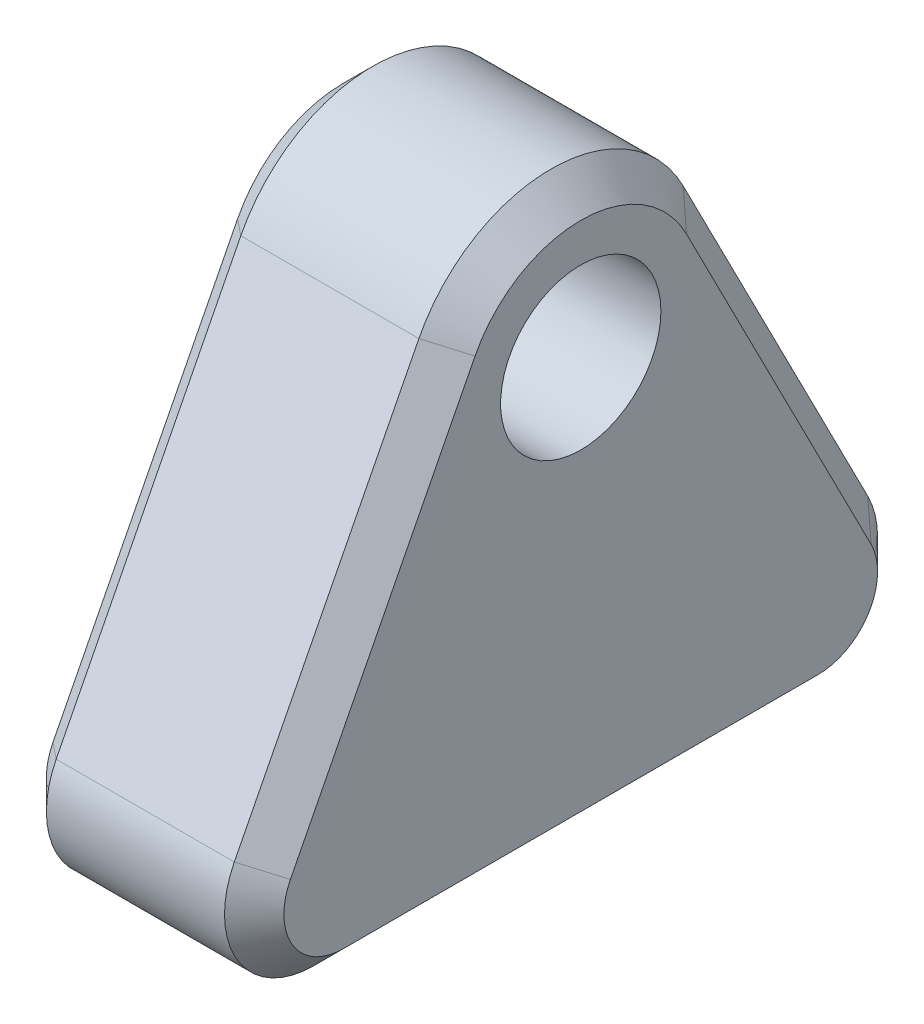
from build123d import *

# Parameters (mm, degrees)
SKETCH1_R           = 2.7
BOSS_EXTRUDE1_DEPTH = 4
CHAMFER1_SIZE       = 1
SKETCH3_R           = 2.4
CUT_EXTRUDE1_DEPTH  = 7
CHAMFER2_SIZE       = 0.5


with BuildPart() as part:
    # Sketch1 → Boss-Extrude1 (new, symmetric)
    with BuildSketch(Plane(origin=(0, 0, 0), x_dir=(0, 0, -1), z_dir=(1, 0, 0))):
        with BuildLine():
            Line((-4.451593815, 2.276688935), (-10.670956289, -9.883986639))
            ThreePointArc((-10.670956289, -9.883986639), (-10.559105321, -12.815560589), (-8, -14.25))
            Line((-8, -14.25), (8, -14.25))
            ThreePointArc((8, -14.25), (10.559105321, -12.815560589), (10.670956289, -9.883986639))
            Line((10.670956289, -9.883986639), (4.451593815, 2.276688935))
            ThreePointArc((4.451593815, 2.276688935), (0, 5), (-4.451593815, 2.276688935))
        make_face()
        Circle(SKETCH1_R, mode=Mode.SUBTRACT)
    extrude(amount=BOSS_EXTRUDE1_DEPTH, both=True)

    # Chamfer1
    chamfer1_edges = [part.edges().sort_by_distance(p)[0] for p in [
        (4, -12.815560589, 10.559105321),
        (4, -14.25, 0),
        (4, -12.815560589, -10.559105321),
        (4, -3.803648852, -7.561275052),
        (4, 5, 0),
        (-4, -3.803648852, -7.561275052),
        (-4, -12.815560589, -10.559105321),
        (-4, -14.25, 0),
        (-4, -12.815560589, 10.559105321),
        (-4, -3.803648852, 7.561275052),
        (-4, 5, 0),
        (4, -3.803648852, 7.561275052),
    ]]
    chamfer(chamfer1_edges, length=CHAMFER1_SIZE)

    # Sketch3 → Cut-Extrude1 (cut)
    with BuildSketch(Plane.XZ.offset(14.25)):
        with Locations(Location((0, 5, 0), (0, 0, 270))):
            Circle(SKETCH3_R)
        with Locations(Location((0, -5, 0), (0, 0, 270))):
            Circle(SKETCH3_R)
    extrude(amount=-CUT_EXTRUDE1_DEPTH, mode=Mode.SUBTRACT)

    # Chamfer2
    chamfer2_edges = [part.edges().sort_by_distance(p)[0] for p in [
        (0, -14.25, 7.4),
        (0, -14.25, -2.6),
    ]]
    chamfer(chamfer2_edges, length=CHAMFER2_SIZE)


solid = part.part
